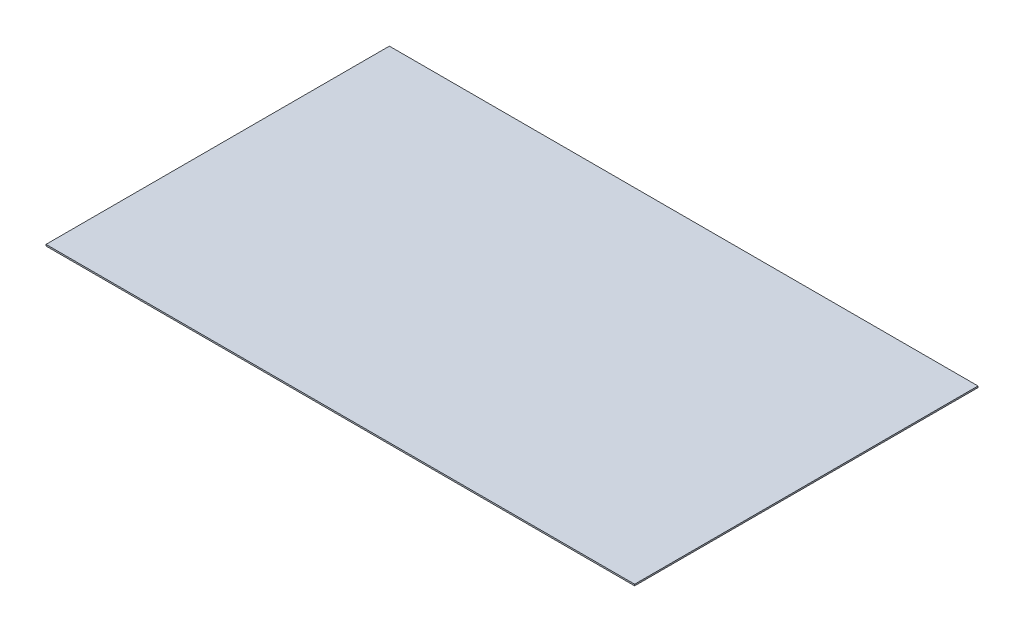
from build123d import *

# Parameters (mm, degrees)
SKETCH1_W           = 1200
SKETCH1_H           = 700
BOSS_EXTRUDE1_DEPTH = 3


with BuildPart() as part:
    # Sketch1 → Boss-Extrude1 (new body)
    with BuildSketch(Plane(origin=(0, 0, 0), x_dir=(1, 0, 0), z_dir=(0, 1, 0))):
        Rectangle(SKETCH1_W, SKETCH1_H)
    extrude(amount=BOSS_EXTRUDE1_DEPTH)


solid = part.part
